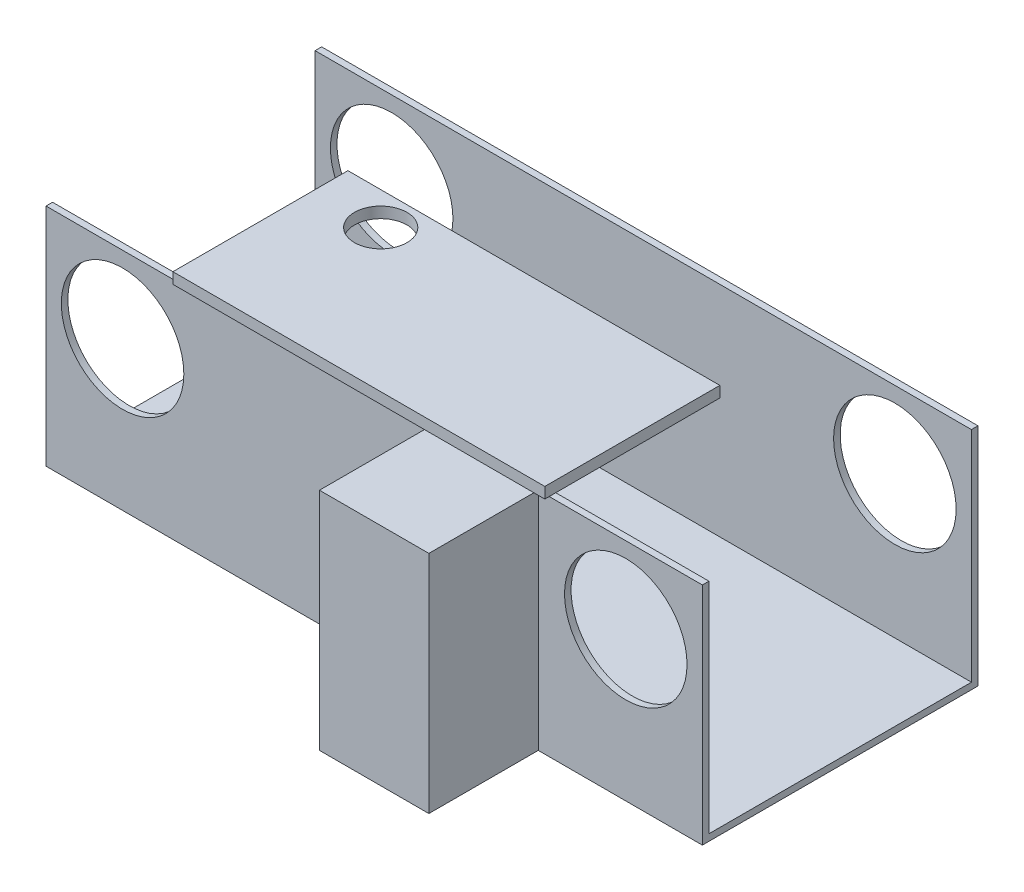
from build123d import *

# Parameters (mm, degrees)
SKETCH1_W            = 300
SKETCH1_H            = 126
BOSS_EXTRUDE2_DEPTH  = 3
SKETCH3_W            = 300
SKETCH3_H            = 3
BOSS_EXTRUDE3_DEPTH  = 100
SKETCH4_R            = 28
CUT_EXTRUDE1_DEPTH   = 186
SKETCH5_W            = 50
SKETCH5_H            = 103
BOSS_EXTRUDE9_DEPTH  = 50
SKETCH9_W            = 170
SKETCH9_H            = 80
SKETCH9_R            = 12
BOSS_EXTRUDE14_DEPTH = 5


with BuildPart() as part:
    # Sketch1 → Boss-Extrude2 (new body)
    with BuildSketch(Plane(origin=(0, 0, 0), x_dir=(1, 0, 0), z_dir=(0, 1, 0))):
        with Locations((3.935860058, -11.344023324)):
            Rectangle(SKETCH1_W, SKETCH1_H)
    extrude(amount=BOSS_EXTRUDE2_DEPTH)

    # Sketch3 → Boss-Extrude3 (add)
    with BuildSketch(Plane(origin=(0, 3, 0), x_dir=(1, 0, 0), z_dir=(0, 1, 0))):
        with Locations((3.935860058, -72.844023324)):
            Rectangle(SKETCH3_W, SKETCH3_H)
        with Locations((3.935860058, 50.155976676)):
            Rectangle(SKETCH3_W, SKETCH3_H)
    extrude(amount=BOSS_EXTRUDE3_DEPTH)

    # Sketch4 → Cut-Extrude1 (cut)
    with BuildSketch(Plane.XY.offset(74.344023324)):
        with Locations((-111.064139942, 68)):
            Circle(SKETCH4_R)
        with Locations((118.935860058, 68)):
            Circle(SKETCH4_R)
    extrude(amount=-CUT_EXTRUDE1_DEPTH, mode=Mode.SUBTRACT)

    # Sketch5 → Boss-Extrude9 (add)
    with BuildSketch(Plane.XY.offset(74.344023324)):
        with Locations((53.935860058, 51.5)):
            Rectangle(SKETCH5_W, SKETCH5_H)
    extrude(amount=BOSS_EXTRUDE9_DEPTH)

    # Sketch9 → Boss-Extrude14 (add)
    with BuildSketch(Plane(origin=(0, 103, 0), x_dir=(1, 0, 0), z_dir=(0, 1, 0))):
        with Locations((-1.064139942, -36.344023324)):
            Rectangle(SKETCH9_W, SKETCH9_H)
        with Locations(Location((-56.064139942, -11.344023324, 0), (0, 0, 270))):
            Circle(SKETCH9_R, mode=Mode.SUBTRACT)
    extrude(amount=BOSS_EXTRUDE14_DEPTH)


solid = part.part
